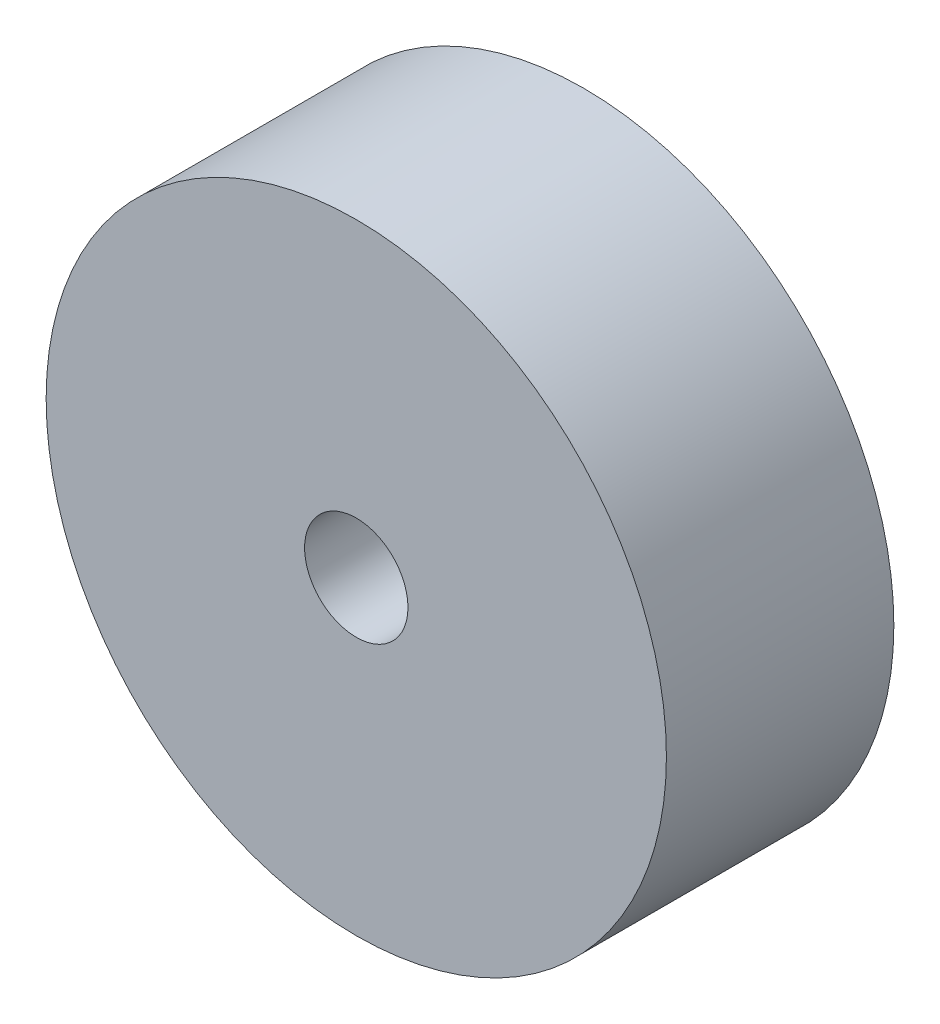
from build123d import *

# Parameters (mm, degrees)
SKETCH_1_R      = 7.5
SKETCH_1_R_2    = 1.25
EXTRUDE_1_DEPTH = 5.5


with BuildPart() as part:
    # 草圖1 → 填料-伸長1 (new body)
    with BuildSketch(Plane.XY):
        with Locations((-13.902883306, 4.645198473)):
            Circle(SKETCH_1_R)
        with Locations((-13.902883306, 4.645198473)):
            Circle(SKETCH_1_R_2, mode=Mode.SUBTRACT)
    extrude(amount=EXTRUDE_1_DEPTH)


solid = part.part
